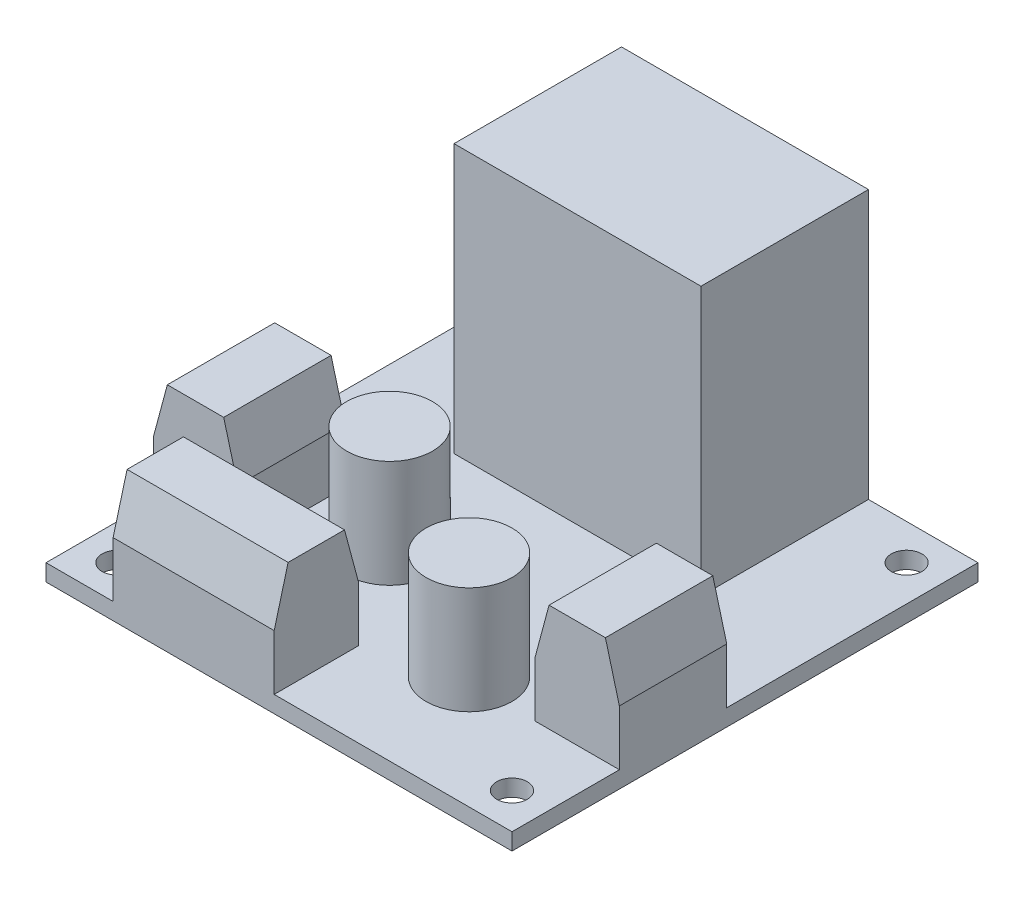
from build123d import *
from OCP.BRepFilletAPI import BRepFilletAPI_MakeChamfer

# Parameters (mm, degrees)
SKETCH2_W           = 43.4
SKETCH2_H           = 43.4
BOSS_EXTRUDE1_DEPTH = 1.56
SKETCH3_W           = 23
SKETCH3_H           = 15.6
BOSS_EXTRUDE2_DEPTH = 25
SKETCH3_3_R         = 4
SKETCH3_3_W         = 7.85
SKETCH3_3_H         = 10
SKETCH3_3_W_2       = 15
SKETCH3_3_H_2       = 7.85
SKETCH3_3_W_3       = 23
SKETCH3_3_H_3       = 15.6
BOSS_EXTRUDE3_DEPTH = 10
CHAMFER1_SIZE       = 1.3
CHAMFER1_SIZE2      = 4.85166605
SKETCH3_4_R         = 1.425
CUT_EXTRUDE1_DEPTH  = 67.273071454


with BuildPart() as part:
    # Sketch2 → Boss-Extrude1 (new body)
    with BuildSketch(Plane(origin=(0, 0, 0), x_dir=(1, 0, 0), z_dir=(0, 1, 0))):
        with Locations((21.7, 21.7)):
            Rectangle(SKETCH2_W, SKETCH2_H)
    extrude(amount=BOSS_EXTRUDE1_DEPTH)

    # Sketch3 → Boss-Extrude2 (add)
    with BuildSketch(Plane(origin=(0, 1.56, 0), x_dir=(1, 0, 0), z_dir=(0, 1, 0))):
        with Locations((21.7, 35.6)):
            Rectangle(SKETCH3_W, SKETCH3_H)
    extrude(amount=BOSS_EXTRUDE2_DEPTH)

    # Sketch3<3> → Boss-Extrude3 (add)
    with BuildSketch(Plane(origin=(0, 1.56, 0), x_dir=(1, 0, 0), z_dir=(0, 1, 0))):
        with Locations(Location((15, 17, 0), (0, 0, 90))):
            Circle(SKETCH3_3_R)
        with Locations((3.925, 15)):
            Rectangle(SKETCH3_3_W, SKETCH3_3_H)
        with Locations((13.75, 3.925)):
            Rectangle(SKETCH3_3_W_2, SKETCH3_3_H_2)
        with Locations(Location((28.9, 10.5, 0), (0, 0, 90))):
            Circle(SKETCH3_3_R)
        with Locations((39.475, 15)):
            Rectangle(SKETCH3_3_W, SKETCH3_3_H)
        with Locations((21.7, 35.6)):
            Rectangle(SKETCH3_3_W_3, SKETCH3_3_H_3)
    extrude(amount=BOSS_EXTRUDE3_DEPTH)

    # Chamfer1: one chamfer whose edges measure the first distance from different faces: ONE call of the kernel's chamfer builder (chamfer() names one face for all edges)
    chamfer1_edges_1 = [part.edges().sort_by_distance(p)[0] for p in [
        (35.55, 11.56, -15),
        (43.4, 11.56, -15),
    ]]
    chamfer1_side_1 = [part.faces().sort_by_distance(p)[0] for p in [
        (39.475, 11.56, -15),
    ]]
    chamfer1_edges_2 = [part.edges().sort_by_distance(p)[0] for p in [
        (13.75, 11.56, -7.85),
        (13.75, 11.56, 0),
    ]]
    chamfer1_side_2 = [part.faces().sort_by_distance(p)[0] for p in [
        (13.75, 11.56, -3.925),
    ]]
    chamfer1_edges_3 = [part.edges().sort_by_distance(p)[0] for p in [
        (7.85, 11.56, -15),
        (0, 11.56, -15),
    ]]
    chamfer1_side_3 = [part.faces().sort_by_distance(p)[0] for p in [
        (3.925, 11.56, -15),
    ]]
    chamfer1 = BRepFilletAPI_MakeChamfer(part.part.solid().wrapped)
    for e in chamfer1_edges_1:
        chamfer1.Add(CHAMFER1_SIZE, CHAMFER1_SIZE2, e.wrapped, chamfer1_side_1[0].wrapped)  # the first distance lies on this face
    for e in chamfer1_edges_2:
        chamfer1.Add(CHAMFER1_SIZE, CHAMFER1_SIZE2, e.wrapped, chamfer1_side_2[0].wrapped)  # the first distance lies on this face
    for e in chamfer1_edges_3:
        chamfer1.Add(CHAMFER1_SIZE, CHAMFER1_SIZE2, e.wrapped, chamfer1_side_3[0].wrapped)  # the first distance lies on this face
    add(Compound.cast(chamfer1.Shape()), mode=Mode.REPLACE)

    # Sketch3<4> → Cut-Extrude1 (cut, through all)
    with BuildSketch(Plane(origin=(0, 1.56, 0), x_dir=(1, 0, 0), z_dir=(0, 1, 0))):
        with Locations(Location((3.325, 40.075, 0), (0, 0, 270))):
            Circle(SKETCH3_4_R)
        with Locations(Location((40.075, 40.075, 0), (0, 0, 270))):
            Circle(SKETCH3_4_R)
        with Locations(Location((40.075, 3.325, 0), (0, 0, 270))):
            Circle(SKETCH3_4_R)
        with Locations(Location((3.325, 3.325, 0), (0, 0, 270))):
            Circle(SKETCH3_4_R)
    extrude(amount=-CUT_EXTRUDE1_DEPTH, mode=Mode.SUBTRACT)


solid = part.part
